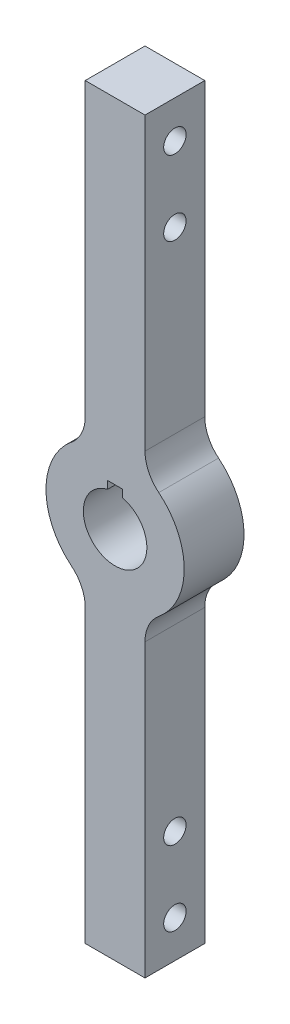
from build123d import *

# Parameters (mm, degrees)
SKETCH1_R           = 18.5
SKETCH1_R_2         = 8.5
BOSS_EXTRUDE1_DEPTH = 8
SKETCH2_W           = 16
SKETCH2_H           = 83.319172682
BOSS_EXTRUDE2_DEPTH = 8
SKETCH3_W           = 16
SKETCH3_H           = 83.319172682
BOSS_EXTRUDE3_DEPTH = 8
SKETCH4_W           = 4
SKETCH4_H           = 2.038644179
CUT_EXTRUDE3_DEPTH  = 103.947802308
FILLET1_R           = 10
SKETCH5_R           = 3
CUT_EXTRUDE4_DEPTH  = 104.760541633


with BuildPart() as part:
    # Sketch1 → Boss-Extrude1 (new, symmetric)
    with BuildSketch(Plane.XY):
        Circle(SKETCH1_R)
        Circle(SKETCH1_R_2, mode=Mode.SUBTRACT)
    extrude(amount=BOSS_EXTRUDE1_DEPTH, both=True)

    # Sketch2 → Boss-Extrude2 (add, symmetric)
    with BuildSketch(Plane.XY):
        with Locations((0, 58.340413659)):
            Rectangle(SKETCH2_W, SKETCH2_H)
    extrude(amount=BOSS_EXTRUDE2_DEPTH, both=True)

    # Sketch3 → Boss-Extrude3 (add, symmetric)
    with BuildSketch(Plane.XY):
        with Locations((0, -58.340413659)):
            Rectangle(SKETCH3_W, SKETCH3_H)
    extrude(amount=BOSS_EXTRUDE3_DEPTH, both=True)

    # Sketch4 → Cut-Extrude3 (cut, through all)
    with BuildSketch(Plane(origin=(0, 0, -8), x_dir=(-1, 0, 0), z_dir=(0, 0, -1))):
        with Locations((0, 9.28067791)):
            Rectangle(SKETCH4_W, SKETCH4_H)
    extrude(amount=-CUT_EXTRUDE3_DEPTH, mode=Mode.SUBTRACT)

    # Fillet1
    fillet1_edges = [part.edges().sort_by_distance(p)[0] for p in [
        (8, 16.680827318, 0),
        (-8, 16.680827318, 0),
        (8, -16.680827318, 0),
        (-8, -16.680827318, 0),
    ]]
    fillet(fillet1_edges, radius=FILLET1_R)

    # Sketch5 → Cut-Extrude4 (cut, through all)
    with BuildSketch(Plane(origin=(8, 0, 0), x_dir=(0, 0, -1), z_dir=(1, 0, 0))):
        with Locations(Location((0, 90, 0), (0, 0, 90))):
            Circle(SKETCH5_R)
        with Locations(Location((0, 70, 0), (0, 0, 90))):
            Circle(SKETCH5_R)
        with Locations(Location((0, -70, 0), (0, 0, 90))):
            Circle(SKETCH5_R)
        with Locations(Location((0, -90, 0), (0, 0, 90))):
            Circle(SKETCH5_R)
    extrude(amount=-CUT_EXTRUDE4_DEPTH, mode=Mode.SUBTRACT)


solid = part.part
